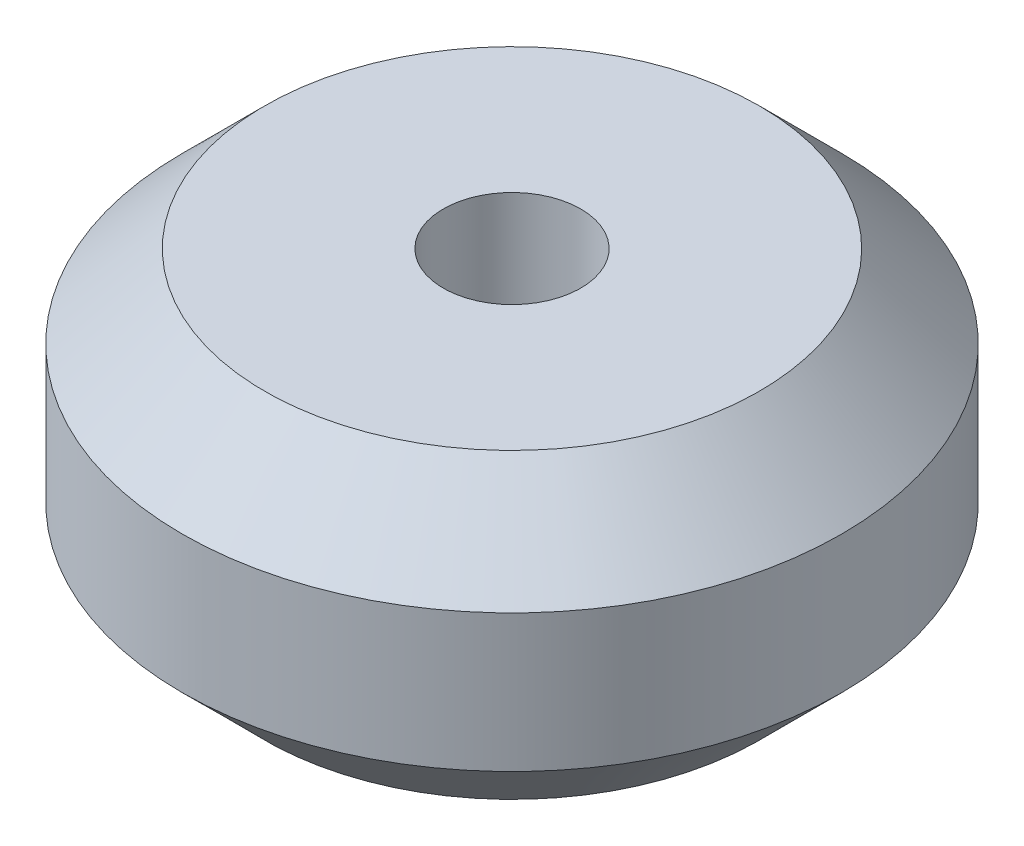
from build123d import *


with BuildPart() as part:
    # Sketch1 → Revolve1 (revolve)
    with BuildSketch(Plane(origin=(0, 0, 0), x_dir=(0, 0, -1), z_dir=(1, 0, 0)), mode=Mode.PRIVATE) as revolve1_sk:
        Polygon((-12, -2.5), (-12, 2.5), (-9, 5.5), (-2.5, 5.5), (-2.5, -5.5), (-9, -5.5), align=None)
    revolve(revolve1_sk.sketch.rotate(Axis((0, 0, 0), (0, 1, 0)), 180), axis=Axis((0, 0, 0), (0, 1, 0)))


solid = part.part
